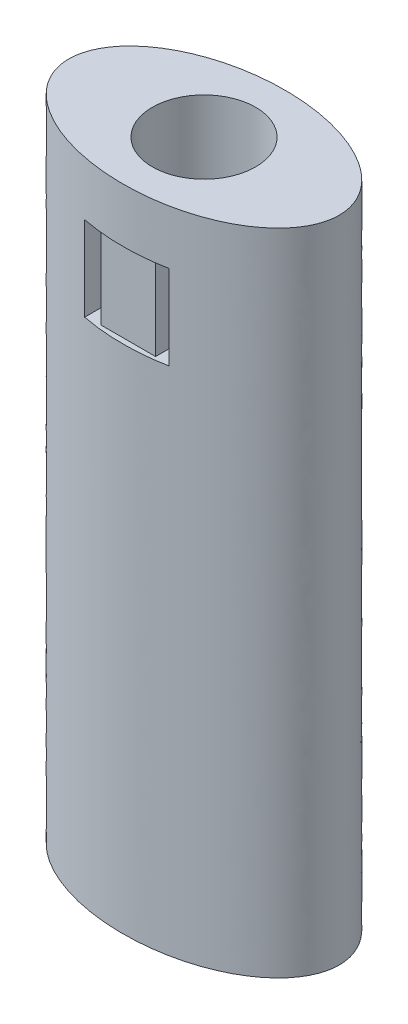
from build123d import *

# Parameters (mm, degrees)
SKETCH_1_RX         = 25
SKETCH_1_RY         = 15
EXTRUDE_1_DEPTH     = 120
SKETCH_2_R          = 9.55
CUT_EXTRUDE_1_DEPTH = 120
CUT_EXTRUDE_START   = 15
SKETCH_3_W          = 15.6
SKETCH_3_H          = 15.6
CUT_EXTRUDE_3_DEPTH = 1
SKETCH_4_W          = 2.75
SKETCH_4_H          = 15.6
CUT_EXTRUDE_4_DEPTH = 3


with BuildPart() as part:
    # 草图1 → 凸台-拉伸1 (new body)
    with BuildSketch(Plane(origin=(0, 0, 0), x_dir=(1, 0, 0), z_dir=(0, 1, 0))):
        with Locations((0, 0)):
            Ellipse(SKETCH_1_RX, SKETCH_1_RY)
    extrude(amount=EXTRUDE_1_DEPTH)

    # 草图2 → 切除-拉伸1 (cut)
    with BuildSketch(Plane.XZ):
        with Locations(Location((0, 0, 0), (0, 0, 270))):
            Circle(SKETCH_2_R)
    extrude(amount=-CUT_EXTRUDE_1_DEPTH, mode=Mode.SUBTRACT)

    # 草图3 → 切除-拉伸3 (cut)
    with BuildSketch(Plane.XY.offset(CUT_EXTRUDE_START)):
        with Locations((0, 102.2)):
            Rectangle(SKETCH_3_W, SKETCH_3_H)
    extrude(amount=-CUT_EXTRUDE_3_DEPTH, mode=Mode.SUBTRACT)

    # 草图4 → 切除-拉伸4 (cut)
    with BuildSketch(Plane.XY.offset(14)):
        with Locations((-6.425, 102.2)):
            Rectangle(SKETCH_4_W, SKETCH_4_H)
        with Locations((6.425, 102.2)):
            Rectangle(SKETCH_4_W, SKETCH_4_H)
    extrude(amount=-CUT_EXTRUDE_4_DEPTH, mode=Mode.SUBTRACT)


solid = part.part
